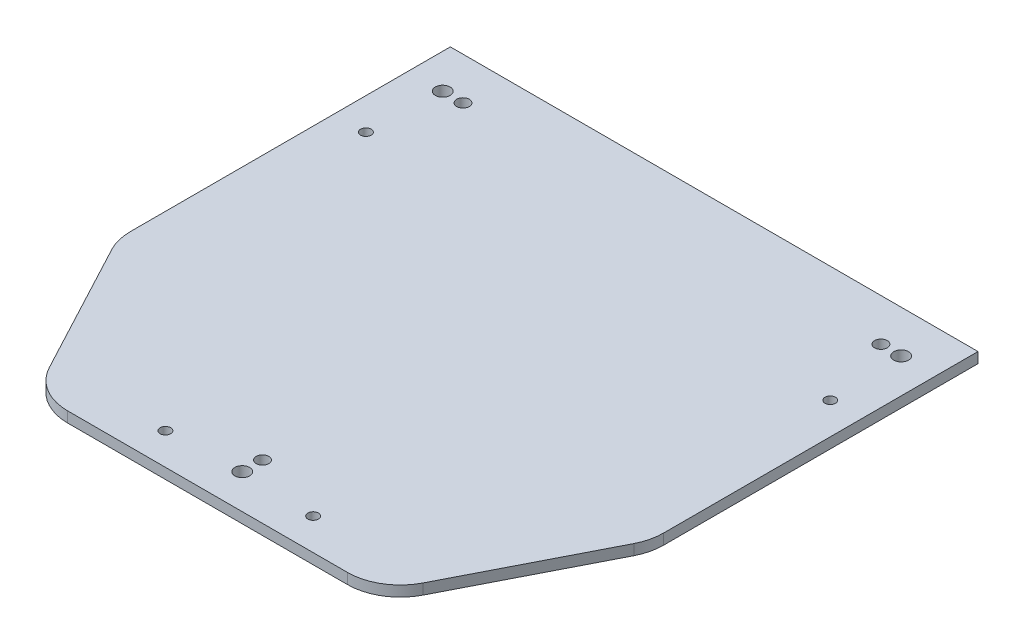
from build123d import *

# Parameters (mm, degrees)
RESSALTO_EXTRUS_O4_DEPTH = 5
ESBO_O2_R                = 2.5
ESBO_O2_R_2              = 3.5
ESBO_O2_R_3              = 3
CORTE_EXTRUS_O1_DEPTH    = 5


with BuildPart() as part:
    # Esboço1 → Ressalto-extrusão4 (new body)
    with BuildSketch(Plane(origin=(0, 0, 0), x_dir=(1, 0, 0), z_dir=(0, 1, 0))):
        with BuildLine():
            Line((470.007423898, -115.796995794), (602.527286899, -115.796995794))
            ThreePointArc((602.527286899, -115.796995794), (615.578185817, -112.120082753), (624.7901231, -102.17091879))
            Line((624.7901231, -102.17091879), (658.530191599, -36.129534592))
            ThreePointArc((658.530191599, -36.129534592), (660.573433908, -30.604931856), (661.267355398, -24.755611597))
            Line((661.267355398, -24.755611597), (661.267355398, 84.203004206))
            Line((661.267355398, 84.203004206), (661.267355398, 124.203004206))
            Line((661.267355398, 124.203004206), (411.267355398, 124.203004206))
            Line((411.267355398, 124.203004206), (411.267355398, 81.588187759))
            Line((411.267355398, 81.588187759), (411.267355398, -27.370428044))
            ThreePointArc((411.267355398, -27.370428044), (412.010540804, -33.420795447), (414.195911055, -39.11143927))
            Line((414.195911055, -39.11143927), (447.935979555, -102.53800702))
            ThreePointArc((447.935979555, -102.53800702), (457.133521627, -112.227409704), (470.007423898, -115.796995794))
        make_face()
    extrude(amount=RESSALTO_EXTRUS_O4_DEPTH)

    # Esboço2 → Corte-extrusão1 (cut)
    with BuildSketch(Plane(origin=(0, 5, 0), x_dir=(1, 0, 0), z_dir=(0, 1, 0))):
        with Locations(Location((571.267355398, -100.796995794, 0), (0, 0, 270))):
            Circle(ESBO_O2_R)
        with Locations(Location((501.267355398, -100.796995794, 0), (0, 0, 270))):
            Circle(ESBO_O2_R)
        with Locations(Location((646.267355398, 69.203004206, 0), (0, 0, 270))):
            Circle(ESBO_O2_R)
        with Locations(Location((426.267355398, 69.203004206, 0), (0, 0, 270))):
            Circle(ESBO_O2_R)
        with Locations(Location((536.267355398, -99.396995794, 0), (0, 0, 270))):
            Circle(ESBO_O2_R_2)
        with Locations(Location((536.267355398, -89.796995794, 0), (0, 0, 270))):
            Circle(ESBO_O2_R_3)
        with Locations(Location((644.867355398, 104.203004206, 0), (0, 0, 270))):
            Circle(ESBO_O2_R_2)
        with Locations(Location((635.267355398, 104.203004206, 0), (0, 0, 270))):
            Circle(ESBO_O2_R_3)
        with Locations(Location((427.667355398, 104.203004206, 0), (0, 0, 270))):
            Circle(ESBO_O2_R_2)
        with Locations(Location((437.267355398, 104.203004206, 0), (0, 0, 270))):
            Circle(ESBO_O2_R_3)
    extrude(amount=-CORTE_EXTRUS_O1_DEPTH, mode=Mode.SUBTRACT)


solid = part.part
